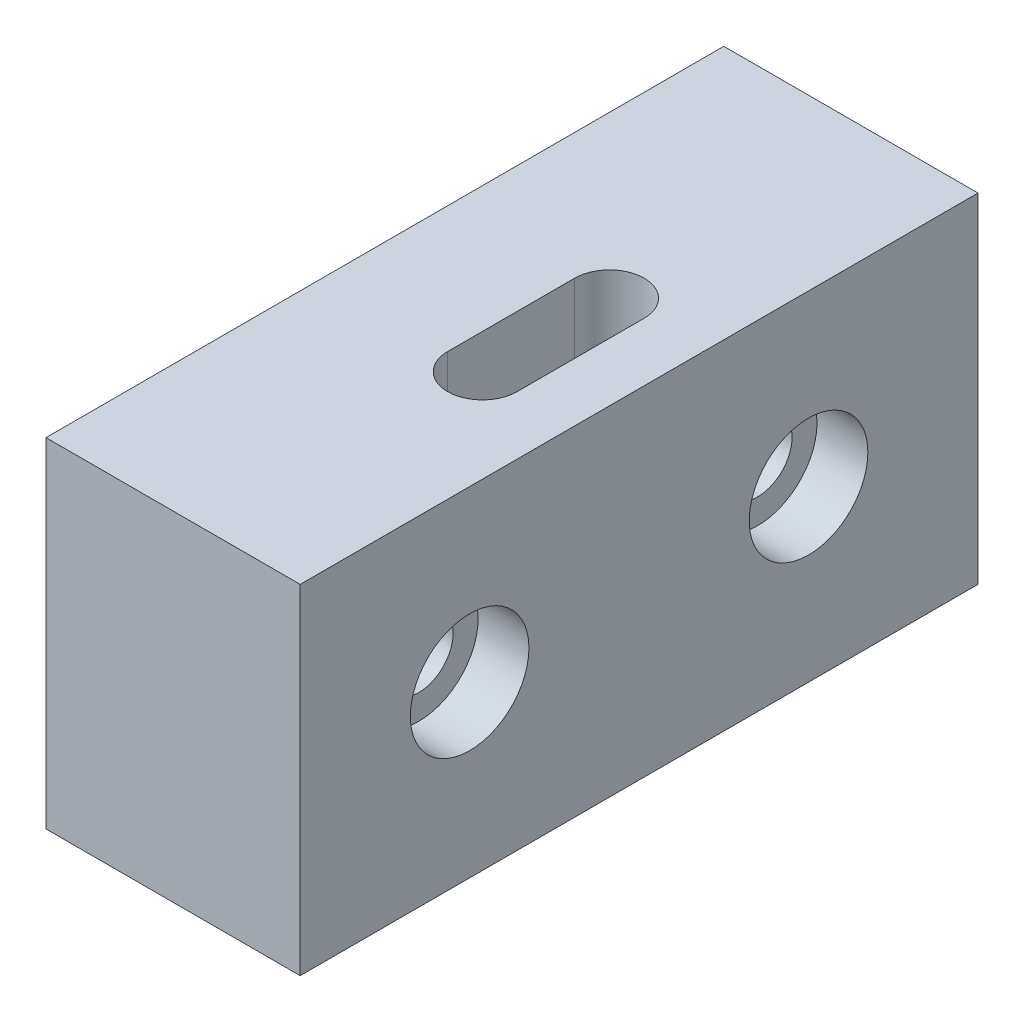
from build123d import *

# Parameters (mm, degrees)
BOSS_EXTRUDE1_DEPTH      = 40
BOSS_EXTRUDE1_DEPTH_BACK = 40
SKETCH1_W                = 30
SKETCH1_H                = 40
CUT_EXTRUDE1_DEPTH       = 80
CUT_EXTRUDE1_DEPTH_BACK  = 80
SKETCH2_R                = 4.05
CUT_EXTRUDE2_START       = 15
SKETCH3_R                = 7
CUT_EXTRUDE2_DEPTH       = 6
CUT_EXTRUDE3_DEPTH       = 36
CUT_EXTRUDE3_DEPTH_BACK  = 36


with BuildPart() as part:
    # Sketch1 → Boss-Extrude1 (new, two sides: drawn at the far end of the back side and taken through both)
    with BuildSketch(Plane.XY.offset(-BOSS_EXTRUDE1_DEPTH_BACK)):
        Rectangle(SKETCH1_W, SKETCH1_H)
    extrude(amount=BOSS_EXTRUDE1_DEPTH + BOSS_EXTRUDE1_DEPTH_BACK)

    # Sketch2 → Cut-Extrude1 (cut, two sides: drawn at the far end of the back side and taken through both)
    with BuildSketch(Plane(origin=(0, 0, 0), x_dir=(0, 0, -1), z_dir=(1, 0, 0)).offset(-CUT_EXTRUDE1_DEPTH_BACK)):
        with Locations((-20, 0)):
            Circle(SKETCH2_R)
        with Locations((20, 0)):
            Circle(SKETCH2_R)
    extrude(amount=CUT_EXTRUDE1_DEPTH + CUT_EXTRUDE1_DEPTH_BACK, mode=Mode.SUBTRACT)

    # Sketch3 → Cut-Extrude2 (cut)
    with BuildSketch(Plane(origin=(0, 0, 0), x_dir=(0, 0, -1), z_dir=(1, 0, 0)).offset(CUT_EXTRUDE2_START)):
        with Locations((-20, 0)):
            Circle(SKETCH3_R)
        with Locations((20, 0)):
            Circle(SKETCH3_R)
    extrude(amount=-CUT_EXTRUDE2_DEPTH, mode=Mode.SUBTRACT)

    # Sketch4 → Cut-Extrude3 (cut, two sides: drawn at the far end of the back side and taken through both)
    with BuildSketch(Plane(origin=(0, 0, 0), x_dir=(1, 0, 0), z_dir=(0, 1, 0)).offset(-CUT_EXTRUDE3_DEPTH_BACK)):
        with BuildLine():
            Line((-0.1, -7.5), (-0.1, 7.5))
            ThreePointArc((-0.1, 7.5), (4, 11.6), (8.1, 7.5))
            Line((8.1, 7.5), (8.1, -7.5))
            ThreePointArc((8.1, -7.5), (4, -11.6), (-0.1, -7.5))
        make_face()
    extrude(amount=CUT_EXTRUDE3_DEPTH + CUT_EXTRUDE3_DEPTH_BACK, mode=Mode.SUBTRACT)


solid = part.part
